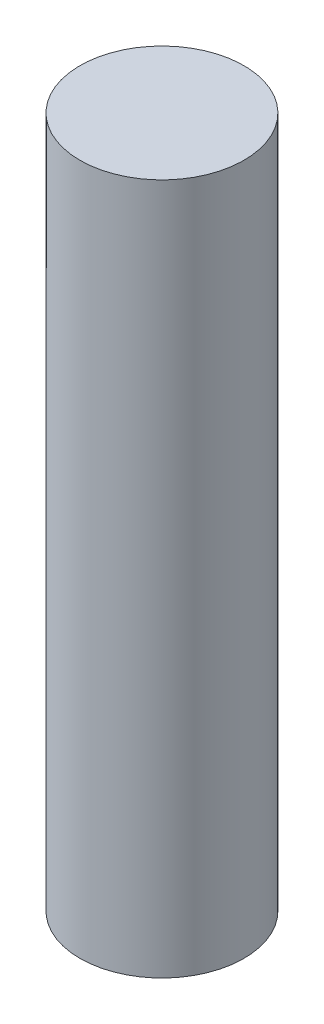
from build123d import *

# Parameters (mm, degrees)
SKETCH1_R           = 350
BOSS_EXTRUDE1_DEPTH = 2950


with BuildPart() as part:
    # Sketch1 → Boss-Extrude1 (new body)
    with BuildSketch(Plane(origin=(0, 0, 0), x_dir=(1, 0, 0), z_dir=(0, 1, 0))):
        with Locations(Location((0, 0, 0), (0, 0, 270))):
            Circle(SKETCH1_R)
    extrude(amount=BOSS_EXTRUDE1_DEPTH)


solid = part.part
